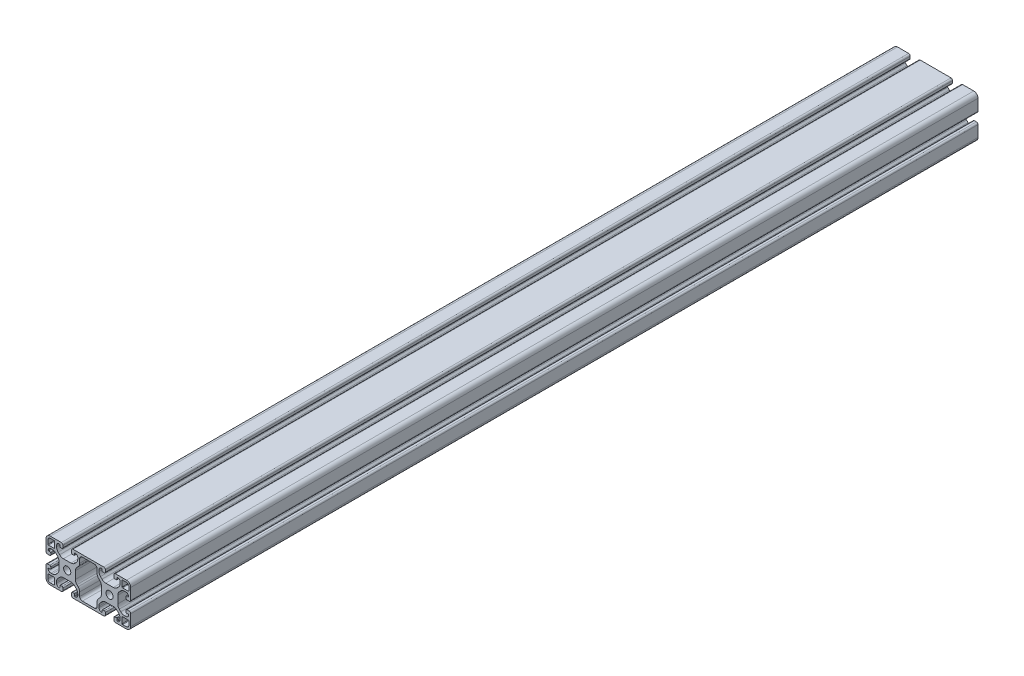
from build123d import *

# Parameters (mm, degrees)
ESQUISSE1_R        = 3.4
BOSS_EXTRU_1_DEPTH = 800


with BuildPart() as part:
    # Esquisse1 → Boss.-Extru.1 (new body)
    with BuildSketch(Plane.XY.offset(20)):
        with BuildLine():
            Line((66.5, 4.5), (65, 4.5))
            ThreePointArc((65, 4.5), (64.292893219, 4.207106781), (64, 3.5))
            Line((64, 3.5), (64, 1.5))
            ThreePointArc((64, 1.5), (64.439339828, 0.439339828), (65.5, 0))
            Line((65.5, 0), (76, 0))
            ThreePointArc((76, 0), (78.828427125, 1.171572875), (80, 4))
            Line((80, 4), (80, 14.5))
            ThreePointArc((80, 14.5), (79.560660172, 15.560660172), (78.5, 16))
            Line((78.5, 16), (76.5, 16))
            ThreePointArc((76.5, 16), (75.792893219, 15.707106781), (75.5, 15))
            Line((75.5, 15), (75.5, 13.5))
            ThreePointArc((75.5, 13.5), (75.646446609, 13.146446609), (76, 13))
            Line((76, 13), (77.5, 13))
            ThreePointArc((77.5, 13), (77.853553391, 12.853553391), (78, 12.5))
            ThreePointArc((78, 12.5), (77.267766953, 10.732233047), (75.5, 10))
            Line((75.5, 10), (74.192388155, 10))
            ThreePointArc((74.192388155, 10), (72.278970994, 10.380602337), (70.656854249, 11.464466094))
            Line((70.656854249, 11.464466094), (69.214466094, 12.906854249))
            ThreePointArc((69.214466094, 12.906854249), (68.130602337, 14.528970994), (67.75, 16.442388155))
            Line((67.75, 16.442388155), (67.75, 23.557611845))
            ThreePointArc((67.75, 23.557611845), (68.130602337, 25.471029006), (69.214466094, 27.093145751))
            Line((69.214466094, 27.093145751), (70.656854249, 28.535533906))
            ThreePointArc((70.656854249, 28.535533906), (72.278970994, 29.619397663), (74.192388155, 30))
            Line((74.192388155, 30), (75.5, 30))
            ThreePointArc((75.5, 30), (77.267766953, 29.267766953), (78, 27.5))
            ThreePointArc((78, 27.5), (77.853553391, 27.146446609), (77.5, 27))
            Line((77.5, 27), (76, 27))
            ThreePointArc((76, 27), (75.646446609, 26.853553391), (75.5, 26.5))
            Line((75.5, 26.5), (75.5, 25))
            ThreePointArc((75.5, 25), (75.792893219, 24.292893219), (76.5, 24))
            Line((76.5, 24), (78.5, 24))
            ThreePointArc((78.5, 24), (79.560660172, 24.439339828), (80, 25.5))
            Line((80, 25.5), (80, 36))
            ThreePointArc((80, 36), (78.828427125, 38.828427125), (76, 40))
            Line((76, 40), (65.5, 40))
            ThreePointArc((65.5, 40), (64.439339828, 39.560660172), (64, 38.5))
            Line((64, 38.5), (64, 36.5))
            ThreePointArc((64, 36.5), (64.292893219, 35.792893219), (65, 35.5))
            Line((65, 35.5), (66.5, 35.5))
            ThreePointArc((66.5, 35.5), (66.853553391, 35.646446609), (67, 36))
            Line((67, 36), (67, 37.5))
            ThreePointArc((67, 37.5), (67.146446609, 37.853553391), (67.5, 38))
            ThreePointArc((67.5, 38), (69.267766953, 37.267766953), (70, 35.5))
            Line((70, 35.5), (70, 34.192388155))
            ThreePointArc((70, 34.192388155), (69.619397663, 32.278970994), (68.535533906, 30.656854249))
            Line((68.535533906, 30.656854249), (67.093145751, 29.214466094))
            ThreePointArc((67.093145751, 29.214466094), (65.471029006, 28.130602337), (63.557611845, 27.75))
            Line((63.557611845, 27.75), (56.442388155, 27.75))
            ThreePointArc((56.442388155, 27.75), (54.528970994, 28.130602337), (52.906854249, 29.214466094))
            Line((52.906854249, 29.214466094), (51.464466094, 30.656854249))
            ThreePointArc((51.464466094, 30.656854249), (50.380602337, 32.278970994), (50, 34.192388155))
            Line((50, 34.192388155), (50, 35.5))
            ThreePointArc((50, 35.5), (50.732233047, 37.267766953), (52.5, 38))
            ThreePointArc((52.5, 38), (52.853553391, 37.853553391), (53, 37.5))
            Line((53, 37.5), (53, 36))
            ThreePointArc((53, 36), (53.146446609, 35.646446609), (53.5, 35.5))
            Line((53.5, 35.5), (55, 35.5))
            ThreePointArc((55, 35.5), (55.707106781, 35.792893219), (56, 36.5))
            Line((56, 36.5), (56, 38.5))
            ThreePointArc((56, 38.5), (55.560660172, 39.560660172), (54.5, 40))
            Line((54.5, 40), (25.5, 40))
            ThreePointArc((25.5, 40), (24.439339828, 39.560660172), (24, 38.5))
            Line((24, 38.5), (24, 36.5))
            ThreePointArc((24, 36.5), (24.292893219, 35.792893219), (25, 35.5))
            Line((25, 35.5), (26.5, 35.5))
            ThreePointArc((26.5, 35.5), (26.853553391, 35.646446609), (27, 36))
            Line((27, 36), (27, 37.5))
            ThreePointArc((27, 37.5), (27.146446609, 37.853553391), (27.5, 38))
            ThreePointArc((27.5, 38), (29.267766953, 37.267766953), (30, 35.5))
            Line((30, 35.5), (30, 34.192388155))
            ThreePointArc((30, 34.192388155), (29.619397663, 32.278970994), (28.535533906, 30.656854249))
            Line((28.535533906, 30.656854249), (27.093145751, 29.214466094))
            ThreePointArc((27.093145751, 29.214466094), (25.471029006, 28.130602337), (23.557611845, 27.75))
            Line((23.557611845, 27.75), (16.442388155, 27.75))
            ThreePointArc((16.442388155, 27.75), (14.528970994, 28.130602337), (12.906854249, 29.214466094))
            Line((12.906854249, 29.214466094), (11.464466094, 30.656854249))
            ThreePointArc((11.464466094, 30.656854249), (10.380602337, 32.278970994), (10, 34.192388155))
            Line((10, 34.192388155), (10, 35.5))
            ThreePointArc((10, 35.5), (10.732233047, 37.267766953), (12.5, 38))
            ThreePointArc((12.5, 38), (12.853553391, 37.853553391), (13, 37.5))
            Line((13, 37.5), (13, 36))
            ThreePointArc((13, 36), (13.146446609, 35.646446609), (13.5, 35.5))
            Line((13.5, 35.5), (15, 35.5))
            ThreePointArc((15, 35.5), (15.707106781, 35.792893219), (16, 36.5))
            Line((16, 36.5), (16, 38.5))
            ThreePointArc((16, 38.5), (15.560660172, 39.560660172), (14.5, 40))
            Line((14.5, 40), (4, 40))
            ThreePointArc((4, 40), (1.171572875, 38.828427125), (0, 36))
            Line((0, 36), (0, 25.5))
            ThreePointArc((0, 25.5), (0.439339828, 24.439339828), (1.5, 24))
            Line((1.5, 24), (3.5, 24))
            ThreePointArc((3.5, 24), (4.207106781, 24.292893219), (4.5, 25))
            Line((4.5, 25), (4.5, 26.5))
            ThreePointArc((4.5, 26.5), (4.353553391, 26.853553391), (4, 27))
            Line((4, 27), (2.5, 27))
            ThreePointArc((2.5, 27), (2.146446609, 27.146446609), (2, 27.5))
            ThreePointArc((2, 27.5), (2.732233047, 29.267766953), (4.5, 30))
            Line((4.5, 30), (5.807611845, 30))
            ThreePointArc((5.807611845, 30), (7.721029006, 29.619397663), (9.343145751, 28.535533906))
            Line((9.343145751, 28.535533906), (10.785533906, 27.093145751))
            ThreePointArc((10.785533906, 27.093145751), (11.869397663, 25.471029006), (12.25, 23.557611845))
            Line((12.25, 23.557611845), (12.25, 16.442388155))
            ThreePointArc((12.25, 16.442388155), (11.869397663, 14.528970994), (10.785533906, 12.906854249))
            Line((10.785533906, 12.906854249), (9.343145751, 11.464466094))
            ThreePointArc((9.343145751, 11.464466094), (7.721029006, 10.380602337), (5.807611845, 10))
            Line((5.807611845, 10), (4.5, 10))
            ThreePointArc((4.5, 10), (2.732233047, 10.732233047), (2, 12.5))
            ThreePointArc((2, 12.5), (2.146446609, 12.853553391), (2.5, 13))
            Line((2.5, 13), (4, 13))
            ThreePointArc((4, 13), (4.353553391, 13.146446609), (4.5, 13.5))
            Line((4.5, 13.5), (4.5, 15))
            ThreePointArc((4.5, 15), (4.207106781, 15.707106781), (3.5, 16))
            Line((3.5, 16), (1.5, 16))
            ThreePointArc((1.5, 16), (0.439339828, 15.560660172), (0, 14.5))
            Line((0, 14.5), (0, 4))
            ThreePointArc((0, 4), (1.171572875, 1.171572875), (4, 0))
            Line((4, 0), (14.5, 0))
            ThreePointArc((14.5, 0), (15.560660172, 0.439339828), (16, 1.5))
            Line((16, 1.5), (16, 3.5))
            ThreePointArc((16, 3.5), (15.707106781, 4.207106781), (15, 4.5))
            Line((15, 4.5), (13.5, 4.5))
            ThreePointArc((13.5, 4.5), (13.146446609, 4.353553391), (13, 4))
            Line((13, 4), (13, 2.5))
            ThreePointArc((13, 2.5), (12.853553391, 2.146446609), (12.5, 2))
            ThreePointArc((12.5, 2), (10.732233047, 2.732233047), (10, 4.5))
            Line((10, 4.5), (10, 5.807611845))
            ThreePointArc((10, 5.807611845), (10.380602337, 7.721029006), (11.464466094, 9.343145751))
            Line((11.464466094, 9.343145751), (12.906854249, 10.785533906))
            ThreePointArc((12.906854249, 10.785533906), (14.528970994, 11.869397663), (16.442388155, 12.25))
            Line((16.442388155, 12.25), (23.557611845, 12.25))
            ThreePointArc((23.557611845, 12.25), (25.471029006, 11.869397663), (27.093145751, 10.785533906))
            Line((27.093145751, 10.785533906), (28.535533906, 9.343145751))
            ThreePointArc((28.535533906, 9.343145751), (29.619397663, 7.721029006), (30, 5.807611845))
            Line((30, 5.807611845), (30, 4.5))
            ThreePointArc((30, 4.5), (29.267766953, 2.732233047), (27.5, 2))
            ThreePointArc((27.5, 2), (27.146446609, 2.146446609), (27, 2.5))
            Line((27, 2.5), (27, 4))
            ThreePointArc((27, 4), (26.853553391, 4.353553391), (26.5, 4.5))
            Line((26.5, 4.5), (25, 4.5))
            ThreePointArc((25, 4.5), (24.292893219, 4.207106781), (24, 3.5))
            Line((24, 3.5), (24, 1.5))
            ThreePointArc((24, 1.5), (24.439339828, 0.439339828), (25.5, 0))
            Line((25.5, 0), (54.5, 0))
            ThreePointArc((54.5, 0), (55.560660172, 0.439339828), (56, 1.5))
            Line((56, 1.5), (56, 3.5))
            ThreePointArc((56, 3.5), (55.707106781, 4.207106781), (55, 4.5))
            Line((55, 4.5), (53.5, 4.5))
            ThreePointArc((53.5, 4.5), (53.146446609, 4.353553391), (53, 4))
            Line((53, 4), (53, 2.5))
            ThreePointArc((53, 2.5), (52.853553391, 2.146446609), (52.5, 2))
            ThreePointArc((52.5, 2), (50.732233047, 2.732233047), (50, 4.5))
            Line((50, 4.5), (50, 5.807611845))
            ThreePointArc((50, 5.807611845), (50.380602337, 7.721029006), (51.464466094, 9.343145751))
            Line((51.464466094, 9.343145751), (52.906854249, 10.785533906))
            ThreePointArc((52.906854249, 10.785533906), (54.528970994, 11.869397663), (56.442388155, 12.25))
            Line((56.442388155, 12.25), (63.557611845, 12.25))
            ThreePointArc((63.557611845, 12.25), (65.471029006, 11.869397663), (67.093145751, 10.785533906))
            Line((67.093145751, 10.785533906), (68.535533906, 9.343145751))
            ThreePointArc((68.535533906, 9.343145751), (69.619397663, 7.721029006), (70, 5.807611845))
            Line((70, 5.807611845), (70, 4.5))
            ThreePointArc((70, 4.5), (69.267766953, 2.732233047), (67.5, 2))
            ThreePointArc((67.5, 2), (67.146446609, 2.146446609), (67, 2.5))
            Line((67, 2.5), (67, 4))
            ThreePointArc((67, 4), (66.853553391, 4.353553391), (66.5, 4.5))
        make_face()
        with Locations(Location((20, 20, 0), (0, 0, 180))):
            Circle(ESQUISSE1_R, mode=Mode.SUBTRACT)
        with Locations(Location((60, 20, 0), (0, 0, 180))):
            Circle(ESQUISSE1_R, mode=Mode.SUBTRACT)
        with BuildLine():
            Line((31.8, 4.5), (31.8, 8.250252532))
            ThreePointArc((31.8, 8.250252532), (31.419397663, 10.163669694), (30.335533906, 11.785786438))
            Line((30.335533906, 11.785786438), (29.214466094, 12.906854249))
            ThreePointArc((29.214466094, 12.906854249), (28.130602337, 14.528970994), (27.75, 16.442388155))
            Line((27.75, 16.442388155), (27.75, 23.557611845))
            ThreePointArc((27.75, 23.557611845), (28.130602337, 25.471029006), (29.214466094, 27.093145751))
            Line((29.214466094, 27.093145751), (30.335533906, 28.214213562))
            ThreePointArc((30.335533906, 28.214213562), (31.419397663, 29.836330306), (31.8, 31.749747468))
            Line((31.8, 31.749747468), (31.8, 35.5))
            ThreePointArc((31.8, 35.5), (32.532233047, 37.267766953), (34.3, 38))
            Line((34.3, 38), (45.7, 38))
            ThreePointArc((45.7, 38), (47.467766953, 37.267766953), (48.2, 35.5))
            Line((48.2, 35.5), (48.2, 31.749747468))
            ThreePointArc((48.2, 31.749747468), (48.580602337, 29.836330306), (49.664466094, 28.214213562))
            Line((49.664466094, 28.214213562), (50.785533906, 27.093145751))
            ThreePointArc((50.785533906, 27.093145751), (51.869397663, 25.471029006), (52.25, 23.557611845))
            Line((52.25, 23.557611845), (52.25, 16.442388155))
            ThreePointArc((52.25, 16.442388155), (51.869397663, 14.528970994), (50.785533906, 12.906854249))
            Line((50.785533906, 12.906854249), (49.664466094, 11.785786438))
            ThreePointArc((49.664466094, 11.785786438), (48.580602337, 10.163669694), (48.2, 8.250252532))
            Line((48.2, 8.250252532), (48.2, 4.5))
            ThreePointArc((48.2, 4.5), (47.467766953, 2.732233047), (45.7, 2))
            Line((45.7, 2), (34.3, 2))
            ThreePointArc((34.3, 2), (32.532233047, 2.732233047), (31.8, 4.5))
        make_face(mode=Mode.SUBTRACT)
        with BuildLine():
            Line((7.7, 1.8), (4, 1.8))
            ThreePointArc((4, 1.8), (2.444365081, 2.444365081), (1.8, 4))
            Line((1.8, 4), (1.8, 7.7))
            ThreePointArc((1.8, 7.7), (1.946446609, 8.053553391), (2.3, 8.2))
            Line((2.3, 8.2), (7.7, 8.2))
            ThreePointArc((7.7, 8.2), (8.053553391, 8.053553391), (8.2, 7.7))
            Line((8.2, 7.7), (8.2, 2.3))
            ThreePointArc((8.2, 2.3), (8.053553391, 1.946446609), (7.7, 1.8))
        make_face(mode=Mode.SUBTRACT)
        with BuildLine():
            Line((72.3, 38.2), (76, 38.2))
            ThreePointArc((76, 38.2), (77.555634919, 37.555634919), (78.2, 36))
            Line((78.2, 36), (78.2, 32.3))
            ThreePointArc((78.2, 32.3), (78.053553391, 31.946446609), (77.7, 31.8))
            Line((77.7, 31.8), (72.3, 31.8))
            ThreePointArc((72.3, 31.8), (71.946446609, 31.946446609), (71.8, 32.3))
            Line((71.8, 32.3), (71.8, 37.7))
            ThreePointArc((71.8, 37.7), (71.946446609, 38.053553391), (72.3, 38.2))
        make_face(mode=Mode.SUBTRACT)
        with BuildLine():
            Line((78.2, 7.7), (78.2, 4))
            ThreePointArc((78.2, 4), (77.555634919, 2.444365081), (76, 1.8))
            Line((76, 1.8), (72.3, 1.8))
            ThreePointArc((72.3, 1.8), (71.946446609, 1.946446609), (71.8, 2.3))
            Line((71.8, 2.3), (71.8, 7.7))
            ThreePointArc((71.8, 7.7), (71.946446609, 8.053553391), (72.3, 8.2))
            Line((72.3, 8.2), (77.7, 8.2))
            ThreePointArc((77.7, 8.2), (78.053553391, 8.053553391), (78.2, 7.7))
        make_face(mode=Mode.SUBTRACT)
        with BuildLine():
            Line((1.8, 32.3), (1.8, 36))
            ThreePointArc((1.8, 36), (2.444365081, 37.555634919), (4, 38.2))
            Line((4, 38.2), (7.7, 38.2))
            ThreePointArc((7.7, 38.2), (8.053553391, 38.053553391), (8.2, 37.7))
            Line((8.2, 37.7), (8.2, 32.3))
            ThreePointArc((8.2, 32.3), (8.053553391, 31.946446609), (7.7, 31.8))
            Line((7.7, 31.8), (2.3, 31.8))
            ThreePointArc((2.3, 31.8), (1.946446609, 31.946446609), (1.8, 32.3))
        make_face(mode=Mode.SUBTRACT)
    extrude(amount=-BOSS_EXTRU_1_DEPTH)


solid = part.part
